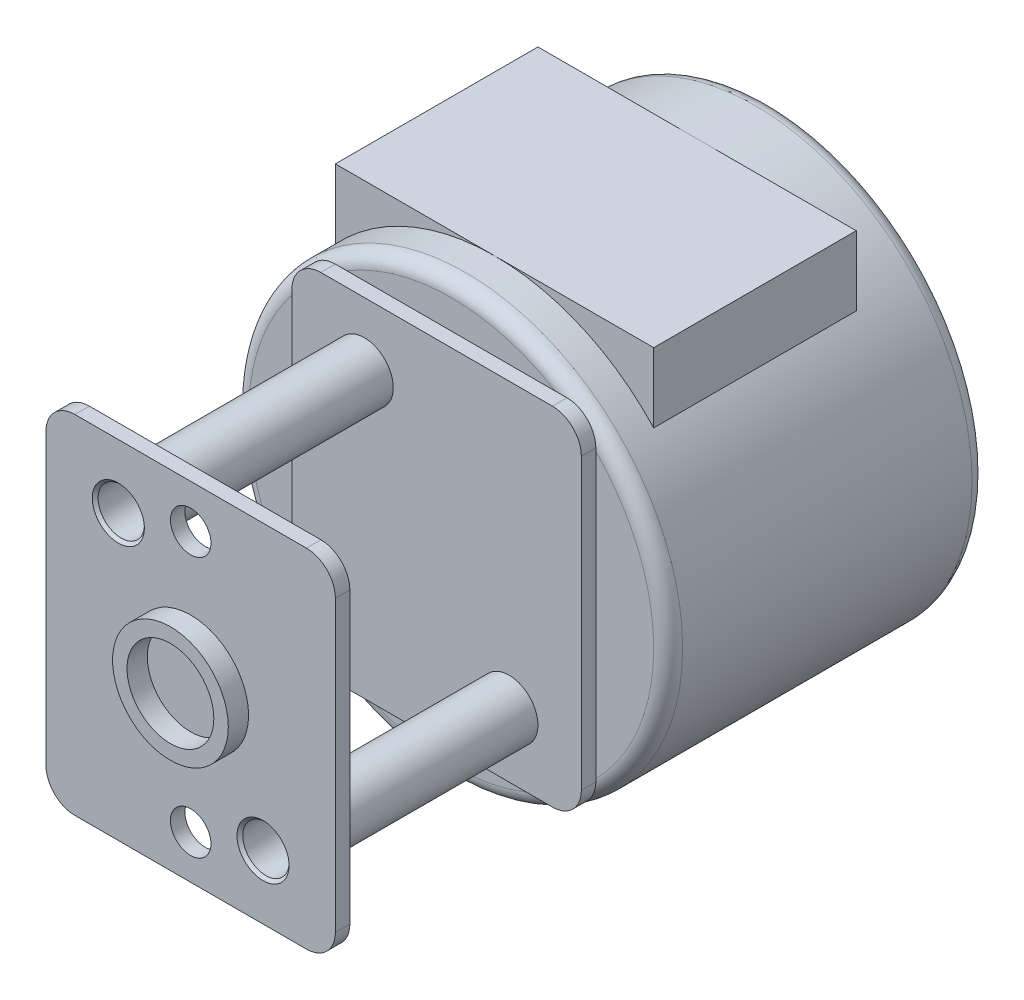
from build123d import *

# Parameters (mm, degrees)
SKETCH1_R           = 7.5
BOSS_EXTRUDE1_DEPTH = 11
FILLET1_R           = 0.5
BOSS_EXTRUDE2_DEPTH = 9
SKETCH3_W           = 20
SKETCH3_H           = 20
CUT_EXTRUDE4_DEPTH  = 4
SKETCH5_R           = 1
BOSS_EXTRUDE3_DEPTH = 8
SKETCH5_3_R         = 0.7
CUT_EXTRUDE5_DEPTH  = 10
SKETCH5_4_R         = 0.8
CUT_EXTRUDE6_DEPTH  = 8.5
SKETCH6_R           = 2
SKETCH6_R_2         = 1.5
BOSS_EXTRUDE4_DEPTH = 0.7
CHAMFER1_SIZE       = 0.1
SKETCH9_W           = 11
SKETCH9_H           = 7
BOSS_EXTRUDE6_DEPTH = 3


with BuildPart() as part:
    # Sketch1 → Boss-Extrude1 (new body)
    with BuildSketch(Plane.XY):
        Circle(SKETCH1_R)
    extrude(amount=BOSS_EXTRUDE1_DEPTH)

    # Fillet1
    fillet1_edges = [part.edges().sort_by_distance(p)[0] for p in [
        (-7.5, 0, 0),
        (-7.5, 0, 11),
    ]]
    fillet(fillet1_edges, radius=FILLET1_R)

    # Sketch2 → Boss-Extrude2 (add)
    with BuildSketch(Plane.XY.offset(11)):
        with BuildLine():
            Line((-4, 6), (4, 6))
            ThreePointArc((4, 6), (4.707106781, 5.707106781), (5, 5))
            Line((5, 5), (5, -5))
            ThreePointArc((5, -5), (4.707106781, -5.707106781), (4, -6))
            Line((4, -6), (-4, -6))
            ThreePointArc((-4, -6), (-4.707106781, -5.707106781), (-5, -5))
            Line((-5, -5), (-5, 5))
            ThreePointArc((-5, 5), (-4.707106781, 5.707106781), (-4, 6))
        make_face()
    extrude(amount=BOSS_EXTRUDE2_DEPTH)

    # Sketch3 → Cut-Extrude4 (cut, symmetric)
    with BuildSketch(Plane.XY.offset(15.5)):
        Rectangle(SKETCH3_W, SKETCH3_H)
    extrude(amount=CUT_EXTRUDE4_DEPTH, both=True, mode=Mode.SUBTRACT)


with BuildPart() as cut_extrude4_piece_1:
    # of the separate pieces the step leaves, piece 1, a body of its own (cut_extrude4_pieces)
    add(part.part.solids().sort_by_distance((7.5, 0, 0.5))[0])



with BuildPart() as cut_extrude4_piece_2:
    # of the separate pieces the step leaves, piece 2, a body of its own (cut_extrude4_pieces)
    add(part.part.solids().sort_by_distance((5, -5, 19.5))[0])


with BuildPart() as cut_extrude4_piece_1_1:
    add(cut_extrude4_piece_1.part)

    add(cut_extrude4_piece_2.part)  # Boss-Extrude3 merges Cut-Extrude4 piece 2
    # Sketch5 → Boss-Extrude3 (add)
    with BuildSketch(Plane.XY.offset(11.5)):
        with Locations((-2.5, 3.8)):
            Circle(SKETCH5_R)
        with Locations((2.5, -3.8)):
            Circle(SKETCH5_R)
    extrude(amount=BOSS_EXTRUDE3_DEPTH)

    # Sketch5<3> → Cut-Extrude5 (cut)
    with BuildSketch(Plane.XY.offset(11.5)):
        with Locations((0, 4.5)):
            Circle(SKETCH5_3_R)
        with Locations((0, -4.5)):
            Circle(SKETCH5_3_R)
    extrude(amount=CUT_EXTRUDE5_DEPTH, mode=Mode.SUBTRACT)

    # Sketch5<4> → Cut-Extrude6 (cut)
    with BuildSketch(Plane.XY.offset(11.5)):
        with Locations((-2.5, 3.8)):
            Circle(SKETCH5_4_R)
        with Locations((2.5, -3.8)):
            Circle(SKETCH5_4_R)
    extrude(amount=CUT_EXTRUDE6_DEPTH, mode=Mode.SUBTRACT)

    # Sketch6 → Boss-Extrude4 (add)
    with BuildSketch(Plane.XY.offset(20)):
        Circle(SKETCH6_R)
        Circle(SKETCH6_R_2, mode=Mode.SUBTRACT)
    extrude(amount=BOSS_EXTRUDE4_DEPTH)

    # Chamfer1
    chamfer1_edges = [cut_extrude4_piece_1_1.edges().sort_by_distance(p)[0] for p in [
        (-3.3, 3.8, 20),
        (1.7, -3.8, 20),
    ]]
    chamfer(chamfer1_edges, length=CHAMFER1_SIZE)

    # Sketch9 → Boss-Extrude6 (add)
    with BuildSketch(Plane(origin=(0, 7.5, 0), x_dir=(1, 0, 0), z_dir=(0, 1, 0))):
        with Locations((0, -6)):
            Rectangle(SKETCH9_W, SKETCH9_H)
    extrude(amount=-BOSS_EXTRUDE6_DEPTH)


solid = cut_extrude4_piece_1_1.part
